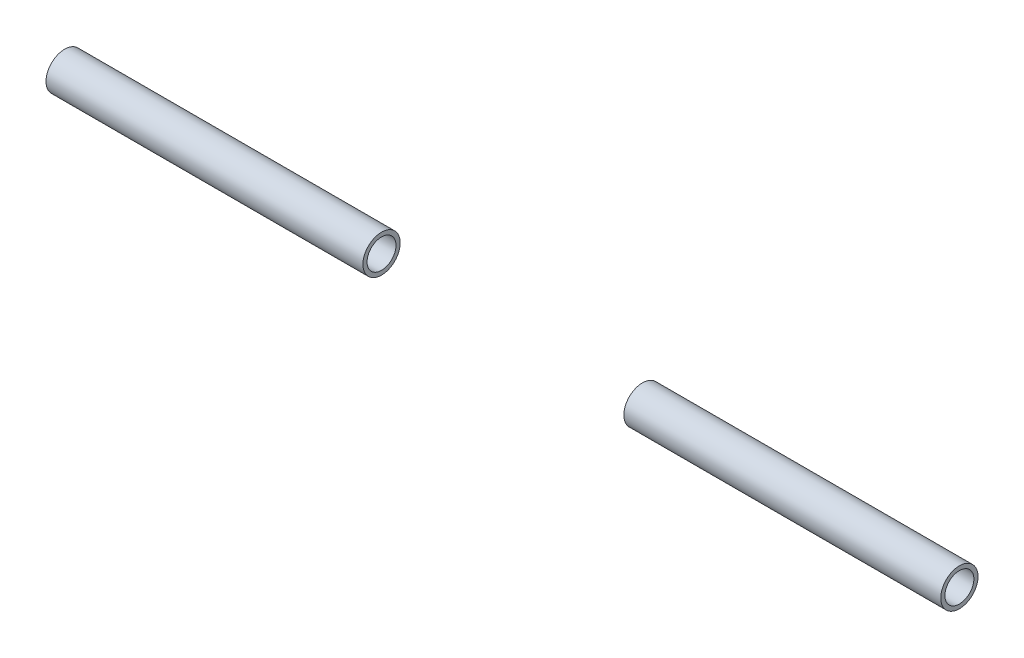
from build123d import *

# Parameters (mm, degrees)
SKETCH3_W               = 152.4
SKETCH3_H               = 0.7112
CUT_EXTRUDE1_DEPTH      = 77.332177029
CUT_EXTRUDE1_DEPTH_BACK = 77.332177029
SKETCH4_W               = 44.45
SKETCH4_H               = 44.45


with BuildPart() as part:
    # Sketch3 → Revolve1 (revolve)
    with BuildSketch(Plane.XY, mode=Mode.PRIVATE) as revolve1_sk:
        with Locations((0, 2.8194)):
            Rectangle(SKETCH3_W, SKETCH3_H)
    revolve(revolve1_sk.sketch.rotate(Axis((-76.2, 0, 0), (1, 0, 0)), 90), axis=Axis((-76.2, 0, 0), (1, 0, 0)))

    # Sketch4 → Cut-Extrude1 (cut, two sides: drawn at the far end of the back side and taken through both)
    with BuildSketch(Plane.XY.offset(-CUT_EXTRUDE1_DEPTH_BACK)):
        Rectangle(SKETCH4_W, SKETCH4_H)
    extrude(amount=CUT_EXTRUDE1_DEPTH + CUT_EXTRUDE1_DEPTH_BACK, mode=Mode.SUBTRACT)


with BuildPart() as cut_extrude1_piece_1:
    # of the separate pieces the step leaves, piece 1, a body of its own (cut_extrude1_pieces)
    add(part.part.solids().sort_by_distance((-76.2, 0, 3.175))[0])


with BuildPart() as cut_extrude1_piece_2:
    # of the separate pieces the step leaves, piece 2, a body of its own (cut_extrude1_pieces)
    add(part.part.solids().sort_by_distance((22.225, 0, 3.175))[0])


solid = Compound([cut_extrude1_piece_1.part, cut_extrude1_piece_2.part])
